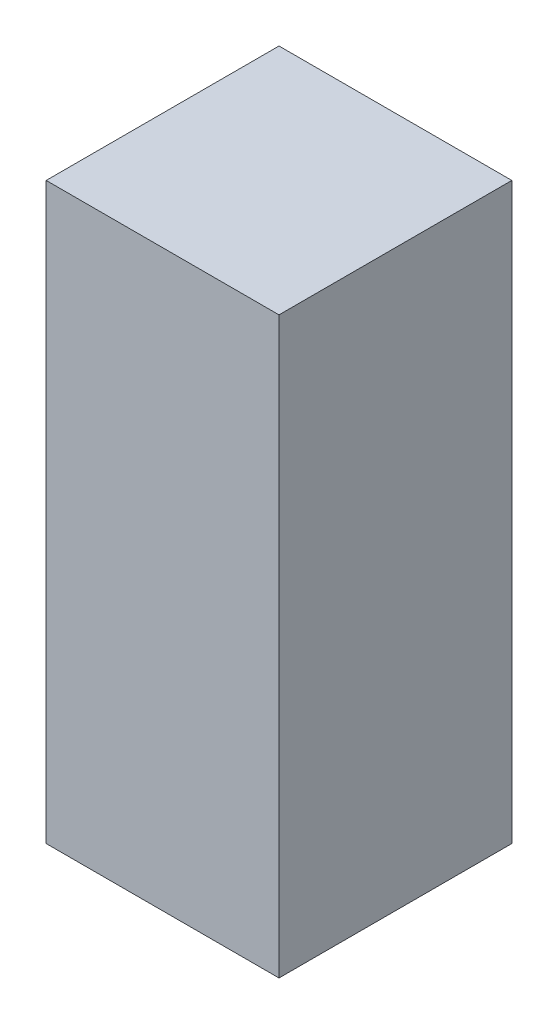
from build123d import *

# Parameters (mm, degrees)
SKETCH1_W           = 38.1
SKETCH1_H           = 38.1
BOSS_EXTRUDE1_DEPTH = 93.98


with BuildPart() as part:
    # Sketch1 → Boss-Extrude1 (new body)
    with BuildSketch(Plane(origin=(0, 0, 0), x_dir=(1, 0, 0), z_dir=(0, 1, 0))):
        with Locations((0.40638529, -0.373654689)):
            Rectangle(SKETCH1_W, SKETCH1_H)
    extrude(amount=BOSS_EXTRUDE1_DEPTH)


solid = part.part
